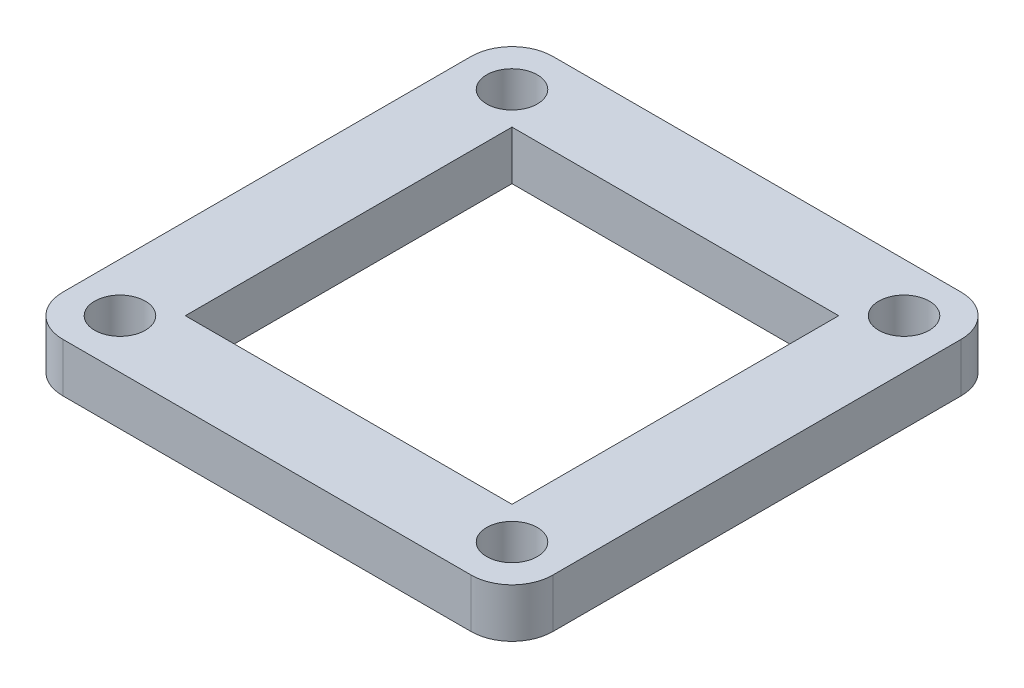
from build123d import *

# Parameters (mm, degrees)
SKETCH1_W           = 30
SKETCH1_H           = 30
SKETCH1_R           = 1.55
SKETCH1_W_2         = 20
SKETCH1_H_2         = 20
BOSS_EXTRUDE1_DEPTH = 3
FILLET2_R           = 2.5


with BuildPart() as part:
    # Sketch1 → Boss-Extrude1 (new body)
    with BuildSketch(Plane(origin=(0, 0, 0), x_dir=(1, 0, 0), z_dir=(0, 1, 0))):
        Rectangle(SKETCH1_W, SKETCH1_H)
        with Locations(Location((12, 12, 0), (0, 0, 270))):
            Circle(SKETCH1_R, mode=Mode.SUBTRACT)
        with Locations(Location((12, -12, 0), (0, 0, 270))):
            Circle(SKETCH1_R, mode=Mode.SUBTRACT)
        with Locations(Location((-12, 12, 0), (0, 0, 270))):
            Circle(SKETCH1_R, mode=Mode.SUBTRACT)
        with Locations(Location((-12, -12, 0), (0, 0, 270))):
            Circle(SKETCH1_R, mode=Mode.SUBTRACT)
        Rectangle(SKETCH1_W_2, SKETCH1_H_2, mode=Mode.SUBTRACT)
    extrude(amount=BOSS_EXTRUDE1_DEPTH)

    # Fillet2
    fillet2_edges = [part.edges().sort_by_distance(p)[0] for p in [
        (15, 1.5, 15),
        (-15, 1.5, 15),
        (-15, 1.5, -15),
        (15, 1.5, -15),
    ]]
    fillet(fillet2_edges, radius=FILLET2_R)


solid = part.part
